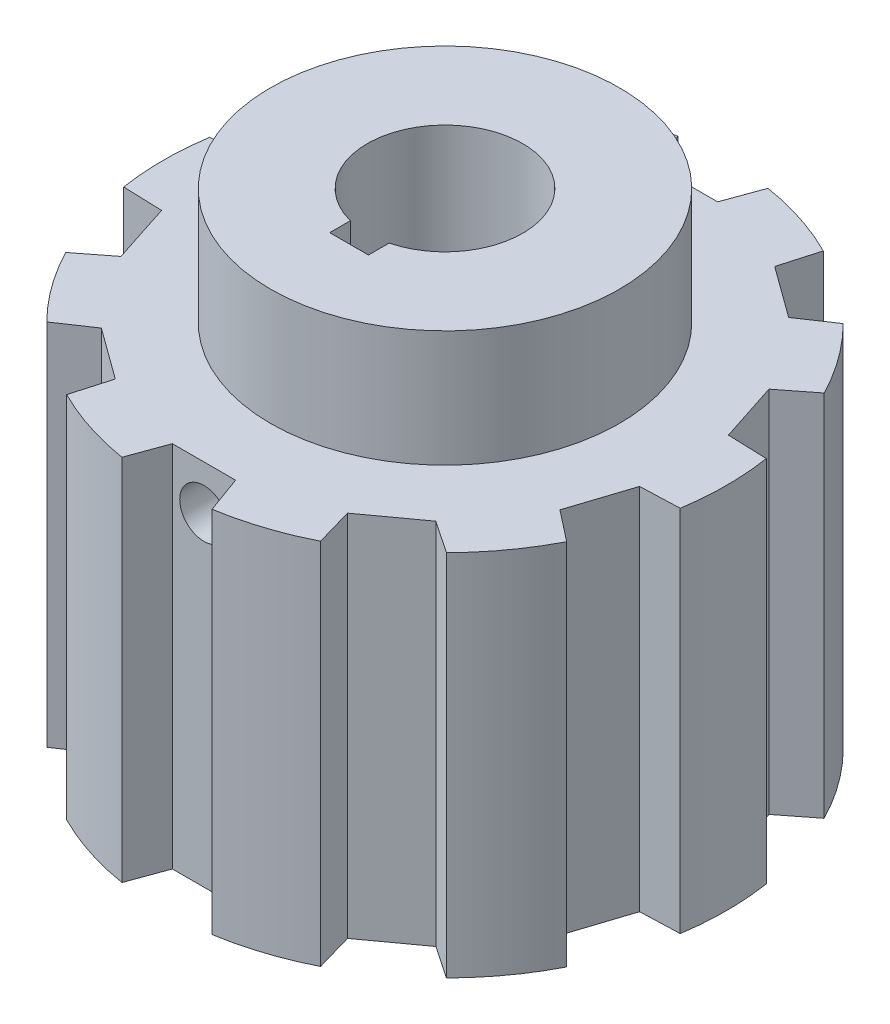
from build123d import *

# Parameters (mm, degrees)
BOSS_EXTRUDE1_DEPTH = 19
SKETCH3_R           = 4.01
CUT_EXTRUDE1_DEPTH  = 29.952983186
BOSS_EXTRUDE2_START = 6
SKETCH5_R           = 9
SKETCH5_R_2         = 4.01
BOSS_EXTRUDE2_DEPTH = 6
SKETCH6_W           = 2
SKETCH6_H           = 3.816021538
CUT_EXTRUDE3_DEPTH  = 34.200530649
SKETCH10_W          = 1.25
SKETCH10_H          = 12.389397068


with BuildPart() as part:
    # Sketch2 → Boss-Extrude1 (new body)
    with BuildSketch(Plane(origin=(0, 0, 0), x_dir=(1, 0, 0), z_dir=(0, 1, 0))):
        with BuildLine():
            Line((7.335535963, -10.343914335), (9.974123377, -8.426868365))
            Line((9.974123377, -8.426868365), (11.654796972, -9.560497019))
            ThreePointArc((11.654796972, -9.560497019), (13.098043776, -7.864477351), (14.265066544, -5.967769174))
            Line((14.265066544, -5.967769174), (12.667564922, -4.719664118))
            Line((12.667564922, -4.719664118), (13.675415632, -1.617818581))
            Line((13.675415632, -1.617818581), (15.701439337, -1.547068275))
            ThreePointArc((15.701439337, -1.547068275), (15.87215518, 0.673359646), (15.701439337, 2.893787567))
            Line((15.701439337, 2.893787567), (13.675415632, 2.964537874))
            Line((13.675415632, 2.964537874), (12.667564922, 6.066383411))
            Line((12.667564922, 6.066383411), (14.265066544, 7.314488466))
            ThreePointArc((14.265066544, 7.314488466), (13.098043776, 9.211196644), (11.654796972, 10.907216312))
            Line((11.654796972, 10.907216312), (9.974123377, 9.773587658))
            Line((9.974123377, 9.773587658), (7.335535963, 11.690633627))
            Line((7.335535963, 11.690633627), (7.894324179, 13.639359722))
            ThreePointArc((7.894324179, 13.639359722), (5.835325832, 14.487870099), (3.670819293, 15.011659646))
            Line((3.670819293, 15.011659646), (2.977455996, 13.106659646))
            Line((2.977455996, 13.106659646), (-0.284017411, 13.106659646))
            Line((-0.284017411, 13.106659646), (-0.977380707, 15.011659646))
            ThreePointArc((-0.977380707, 15.011659646), (-3.141887247, 14.487870099), (-5.200885594, 13.639359722))
            Line((-5.200885594, 13.639359722), (-4.642097378, 11.690633627))
            Line((-4.642097378, 11.690633627), (-7.280684791, 9.773587658))
            Line((-7.280684791, 9.773587658), (-8.961358387, 10.907216312))
            ThreePointArc((-8.961358387, 10.907216312), (-10.40460519, 9.211196644), (-11.571627958, 7.314488466))
            Line((-11.571627958, 7.314488466), (-9.974126336, 6.066383411))
            Line((-9.974126336, 6.066383411), (-10.981977046, 2.964537874))
            Line((-10.981977046, 2.964537874), (-13.008000751, 2.893787567))
            ThreePointArc((-13.008000751, 2.893787567), (-13.178716594, 0.673359646), (-13.008000751, -1.547068275))
            Line((-13.008000751, -1.547068275), (-10.981977046, -1.617818581))
            Line((-10.981977046, -1.617818581), (-9.974126336, -4.719664118))
            Line((-9.974126336, -4.719664118), (-11.571627958, -5.967769174))
            ThreePointArc((-11.571627958, -5.967769174), (-10.40460519, -7.864477351), (-8.961358387, -9.560497019))
            Line((-8.961358387, -9.560497019), (-7.280684791, -8.426868365))
            Line((-7.280684791, -8.426868365), (-4.642097378, -10.343914335))
            Line((-4.642097378, -10.343914335), (-5.200885594, -12.292640429))
            ThreePointArc((-5.200885594, -12.292640429), (-3.141887247, -13.141150806), (-0.977380707, -13.664940354))
            Line((-0.977380707, -13.664940354), (-0.284017411, -11.759940354))
            Line((-0.284017411, -11.759940354), (2.977455996, -11.759940354))
            Line((2.977455996, -11.759940354), (3.670819293, -13.664940354))
            ThreePointArc((3.670819293, -13.664940354), (5.835325832, -13.141150806), (7.894324179, -12.292640429))
            Line((7.894324179, -12.292640429), (7.335535963, -10.343914335))
        make_face()
    extrude(amount=BOSS_EXTRUDE1_DEPTH)

    # Sketch3 → Cut-Extrude1 (cut, through all)
    with BuildSketch(Plane(origin=(0, 19, 0), x_dir=(1, 0, 0), z_dir=(0, 1, 0))):
        with Locations(Location((1.346719293, 0.673359646, 0), (0, 0, 270))):
            Circle(SKETCH3_R)
    extrude(amount=-CUT_EXTRUDE1_DEPTH, mode=Mode.SUBTRACT)

    # Sketch5 → Boss-Extrude2 (add)
    with BuildSketch(Plane(origin=(0, 19, 0), x_dir=(1, 0, 0), z_dir=(0, 1, 0)).offset(BOSS_EXTRUDE2_START)):
        with Locations(Location((1.346719293, 0.673359646, 0), (0, 0, 270))):
            Circle(SKETCH5_R)
        with Locations(Location((1.346719293, 0.673359646, 0), (0, 0, 270))):
            Circle(SKETCH5_R_2, mode=Mode.SUBTRACT)
    extrude(amount=-BOSS_EXTRUDE2_DEPTH)

    # Sketch6 → Cut-Extrude3 (cut, through all)
    with BuildSketch(Plane(origin=(0, 25, 0), x_dir=(1, 0, 0), z_dir=(0, 1, 0))):
        with Locations((1.346719293, -2.367532517)):
            Rectangle(SKETCH6_W, SKETCH6_H)
    extrude(amount=-CUT_EXTRUDE3_DEPTH, mode=Mode.SUBTRACT)

    # Sketch10 → M3x0.5 Tapped Hole2 (revolve, cut)
    with BuildSketch(Plane(origin=(1.346719293, 16.7, 1.275543286), x_dir=(0, 1, 0), z_dir=(1, 0, 0))):
        with Locations((0.625, 6.194698534)):
            Rectangle(SKETCH10_W, SKETCH10_H)
    revolve(axis=Axis((1.346719293, 16.7, -5.074456714), (0, 0, 1)), mode=Mode.SUBTRACT)


solid = part.part
